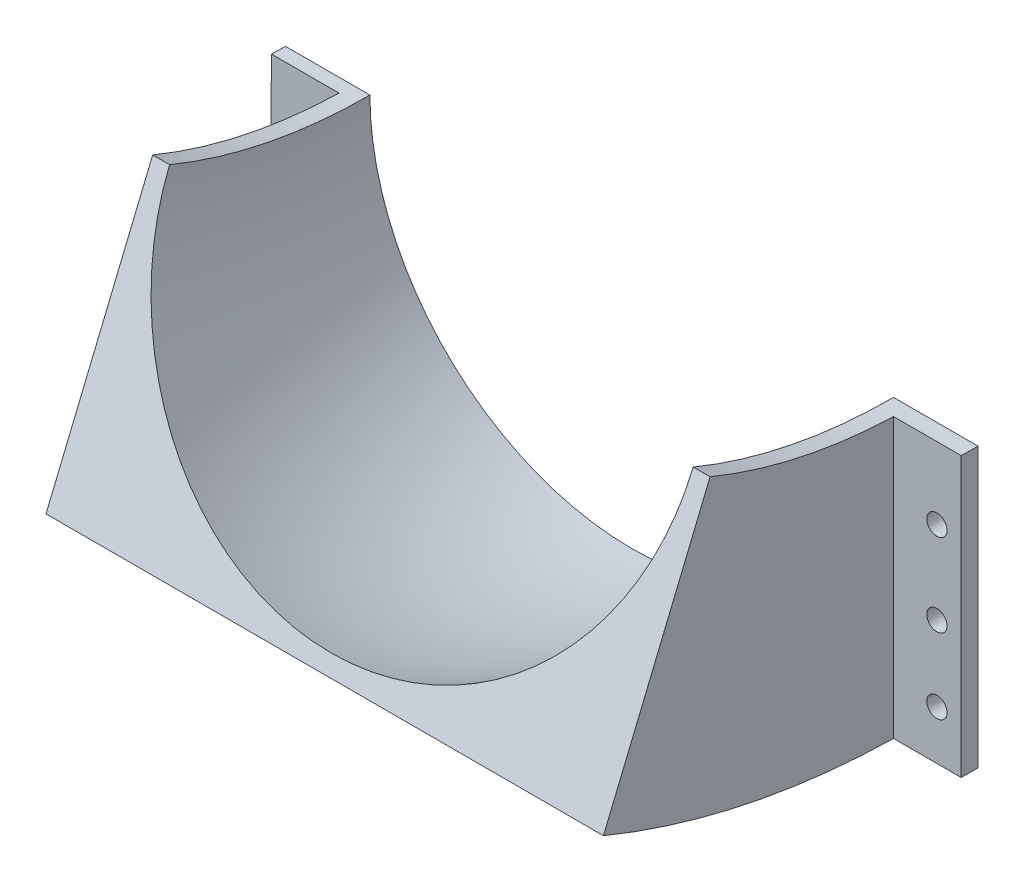
from build123d import *

# Parameters (mm, degrees)
REVOLVE8_ANGLE      = 22.5
BOSS_EXTRUDE3_START = 12.7
BOSS_EXTRUDE3_DEPTH = 12.7
BOSS_EXTRUDE4_DEPTH = 12.7
SKETCH12_R          = 1.905
CUT_EXTRUDE4_DEPTH  = 3.175
SKETCH13_R          = 1.905
CUT_EXTRUDE5_DEPTH  = 3.175


with BuildPart() as part:
    # Sketch9 → Revolve8 (revolve)
    with BuildSketch(Plane.XY):
        with BuildLine():
            Line((-49.2252, -98.425), (-52.4002, -98.425))
            Line((-52.4002, -98.425), (-52.4002, -150.8252))
            Line((-52.4002, -150.8252), (52.4002, -150.8252))
            Line((52.4002, -150.8252), (52.4002, -98.425))
            Line((52.4002, -98.425), (49.2252, -98.425))
            ThreePointArc((49.2252, -98.425), (0, -147.6502), (-49.2252, -98.425))
        make_face()
    revolve(axis=Axis((-38.048924234, 0, 0), (-1, 0, 0)), revolution_arc=REVOLVE8_ANGLE)

    # Sketch11 → Boss-Extrude3 (add)
    with BuildSketch(Plane.ZY.offset(52.4002).offset(BOSS_EXTRUDE3_START)):
        with BuildLine():
            Line((0, -98.425), (0, -150.8252))
            ThreePointArc((0, -150.8252), (1.5875, -150.816845209), (3.174824124, -150.791781762))
            Line((3.174824124, -150.791781762), (2.623242695, -98.390036197))
            ThreePointArc((2.623242695, -98.390036197), (1.311737846, -98.416258661), (0, -98.425))
        make_face()
    extrude(amount=-BOSS_EXTRUDE3_DEPTH)

    # Sketch10 → Boss-Extrude4 (add)
    with BuildSketch(Plane(origin=(52.4002, 0, 0), x_dir=(0, 0, -1), z_dir=(1, 0, 0))):
        with BuildLine():
            Line((0, -98.425), (0, -150.8252))
            Line((0, -150.8252), (-3.174824124, -150.791781762))
            Line((-3.174824124, -150.791781762), (-3.174824124, -98.37378267))
            ThreePointArc((-3.174824124, -98.37378267), (-1.587618613, -98.412194834), (0, -98.425))
        make_face()
    extrude(amount=BOSS_EXTRUDE4_DEPTH)

    # Sketch12 → Cut-Extrude4 (cut)
    with BuildSketch(Plane.XY.offset(3.174824124)):
        with Locations((60.550186424, -111.886000657)):
            Circle(SKETCH12_R)
        with Locations((60.550186424, -141.566764633)):
            Circle(SKETCH12_R)
        with Locations((60.550186424, -127.4445)):
            Circle(SKETCH12_R)
    extrude(amount=-CUT_EXTRUDE4_DEPTH, mode=Mode.SUBTRACT)

    # Sketch13 → Cut-Extrude5 (cut)
    with BuildSketch(Plane(origin=(0, -0.008353865, 1.587675876), x_dir=(1, 0, 0), z_dir=(-8.55203915581382e-15, 0.010525429437517081, 0.9999446061333377))):
        with Locations(Location((-60.754019077, -141.521938379, 0), (0, 0, 270))):
            Circle(SKETCH13_R)
        with Locations(Location((-60.754019077, -112.479497113, 0), (0, 0, 270))):
            Circle(SKETCH13_R)
        with Locations(Location((-60.754019077, -127.4445, 0), (0, 0, 270))):
            Circle(SKETCH13_R)
    extrude(amount=-CUT_EXTRUDE5_DEPTH, mode=Mode.SUBTRACT)


solid = part.part
